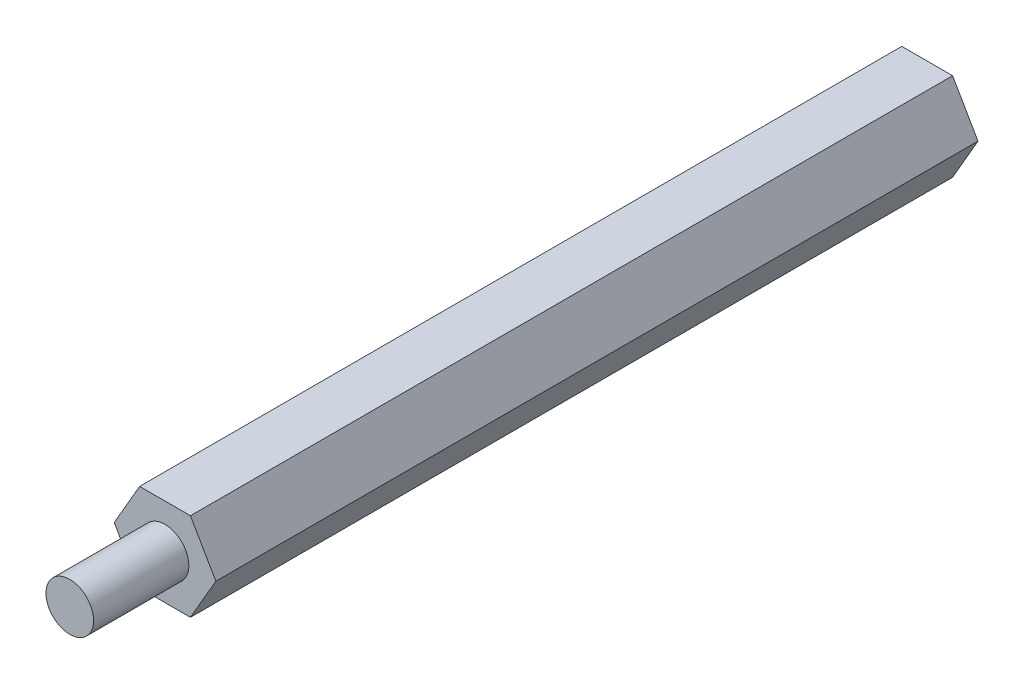
from build123d import *

# Parameters (mm, degrees)
EXTRUDE_1_DEPTH     = 48
SKETCH_4_R          = 1.5
CUT_EXTRUDE_1_DEPTH = 6
SKETCH_5_R          = 1.5
EXTRUDE_2_DEPTH     = 6


with BuildPart() as part:
    # 草图3 → 凸台-拉伸1 (new body)
    with BuildSketch(Plane.XY):
        Polygon((1.6, 2.771281292), (-1.6, 2.771281292), (-3.2, 0), (-1.6, -2.771281292), (1.6, -2.771281292), (3.2, 0), align=None)
    extrude(amount=EXTRUDE_1_DEPTH)

    # 草图4 → 切除-拉伸1 (cut)
    with BuildSketch(Plane(origin=(0, 0, 0), x_dir=(-1, 0, 0), z_dir=(0, 0, -1))):
        Circle(SKETCH_4_R)
    extrude(amount=-CUT_EXTRUDE_1_DEPTH, mode=Mode.SUBTRACT)

    # 草图5 → 凸台-拉伸2 (add)
    with BuildSketch(Plane.XY.offset(48)):
        with Locations(Location((0, 0, 0), (0, 0, 180))):
            Circle(SKETCH_5_R)
    extrude(amount=EXTRUDE_2_DEPTH)


solid = part.part
